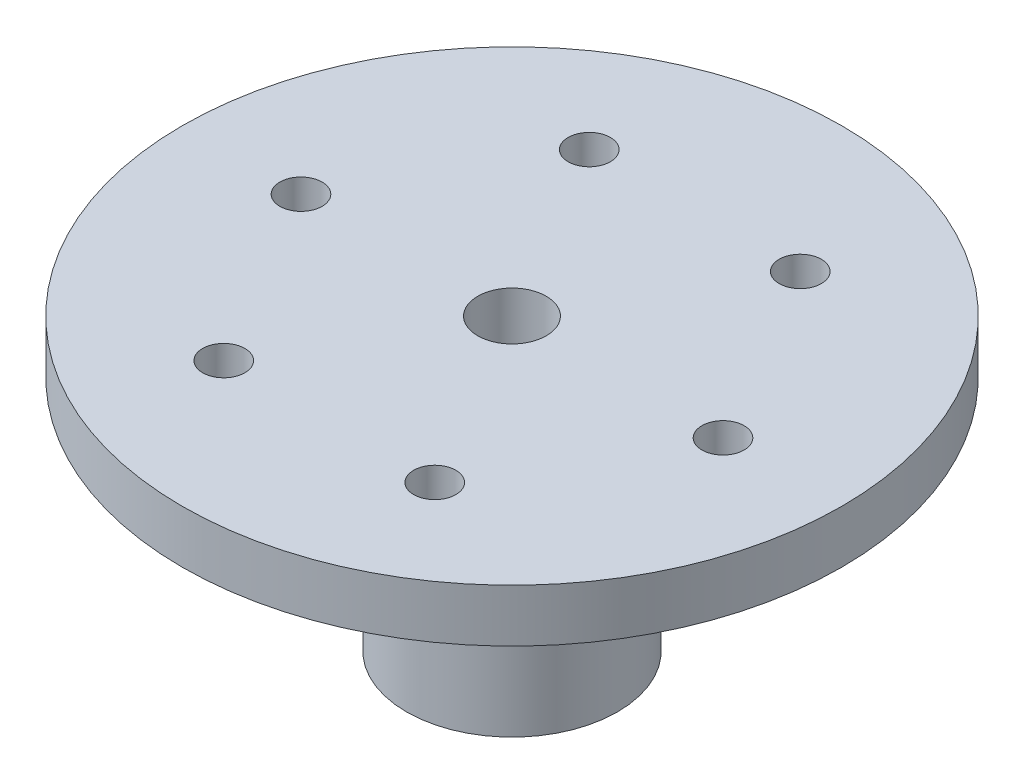
from build123d import *

# Parameters (mm, degrees)
SKETCH_1_R          = 8
SKETCH_1_R_2        = 2.6
EXTRUDE_1_DEPTH     = 18
SKETCH_2_R          = 25
SKETCH_2_R_2        = 1.6
EXTRUDE_2_DEPTH     = 4
SKETCH_4_R          = 2.4
CUT_EXTRUDE_1_DEPTH = 10
SKETCH_5_R          = 2.6
CUT_EXTRUDE_2_DEPTH = 10


with BuildPart() as part:
    # 草图1 → 凸台-拉伸1 (new body)
    with BuildSketch(Plane(origin=(0, 0, 0), x_dir=(1, 0, 0), z_dir=(0, 1, 0))):
        with Locations(Location((0, 0, 0), (0, 0, 270))):
            Circle(SKETCH_1_R)
        with Locations(Location((0, 0, 0), (0, 0, 270))):
            Circle(SKETCH_1_R_2, mode=Mode.SUBTRACT)
    extrude(amount=EXTRUDE_1_DEPTH)

    # 草图2 → 凸台-拉伸2 (add)
    with BuildSketch(Plane(origin=(0, 18, 0), x_dir=(1, 0, 0), z_dir=(0, 1, 0))):
        with Locations(Location((0, 0, 0), (0, 0, 270))):
            Circle(SKETCH_2_R)
        with Locations(Location((16, 0, 0), (0, 0, 270))):
            Circle(SKETCH_2_R_2, mode=Mode.SUBTRACT)
        with Locations(Location((8, -13.856406461, 0), (0, 0, 270))):
            Circle(SKETCH_2_R_2, mode=Mode.SUBTRACT)
        with Locations(Location((-8, -13.856406461, 0), (0, 0, 270))):
            Circle(SKETCH_2_R_2, mode=Mode.SUBTRACT)
        with Locations(Location((-16, 0, 0), (0, 0, 270))):
            Circle(SKETCH_2_R_2, mode=Mode.SUBTRACT)
        with Locations(Location((-8, 13.856406461, 0), (0, 0, 270))):
            Circle(SKETCH_2_R_2, mode=Mode.SUBTRACT)
        with Locations(Location((8, 13.856406461, 0), (0, 0, 270))):
            Circle(SKETCH_2_R_2, mode=Mode.SUBTRACT)
    extrude(amount=EXTRUDE_2_DEPTH)

    # 草图4 → 切除-拉伸1 (cut)
    with BuildSketch(Plane.XY):
        with Locations(Location((0, 10, 0), (0, 0, 90))):
            Circle(SKETCH_4_R)
    extrude(amount=-CUT_EXTRUDE_1_DEPTH, mode=Mode.SUBTRACT)

    # 草图5 → 切除-拉伸2 (cut)
    with BuildSketch(Plane.XZ.offset(-18)):
        with Locations(Location((0, 0, 0), (0, 0, 90))):
            Circle(SKETCH_5_R)
    extrude(amount=-CUT_EXTRUDE_2_DEPTH, mode=Mode.SUBTRACT)


solid = part.part
